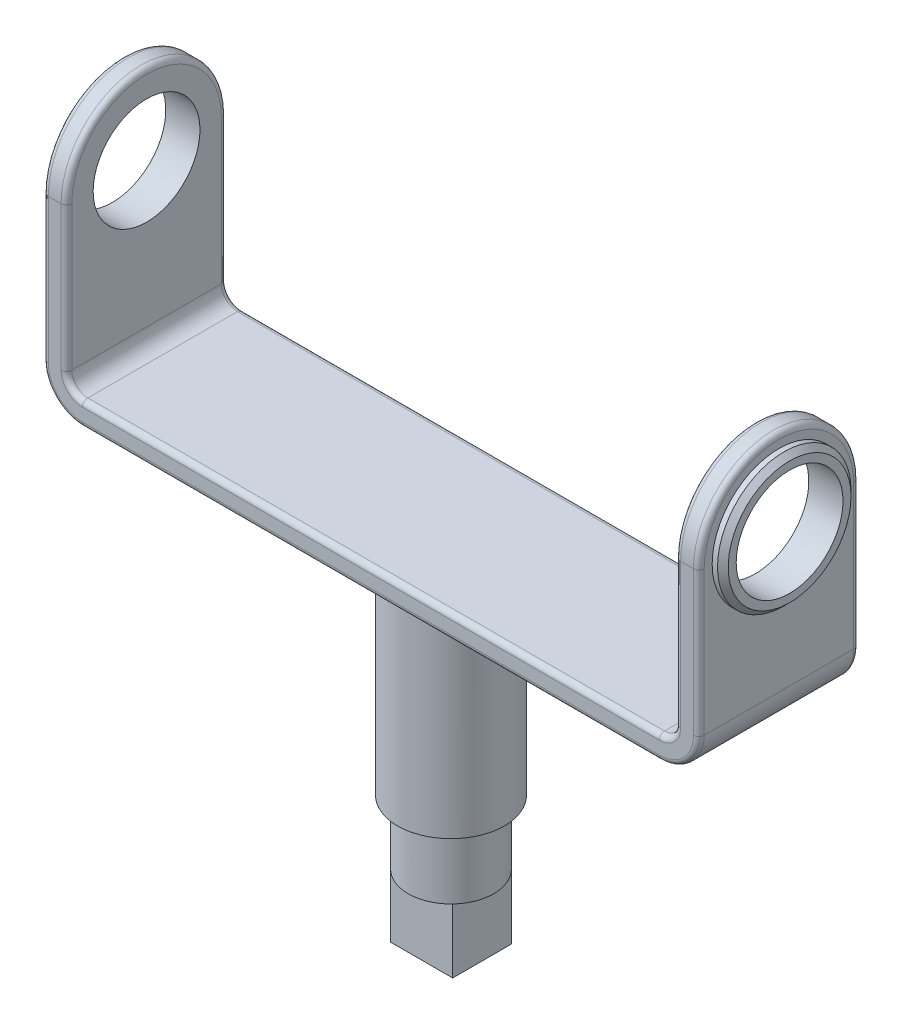
from build123d import *
from build123d.topology import SkipClean

# Parameters (mm, degrees)
EXTRUDE_THIN1_DEPTH     = 7.5
BOSS_EXTRUDE4_DEPTH     = 2.2
BOSS_EXTRUDE5_START     = -2.2
BOSS_EXTRUDE5_DEPTH     = 2.2
CUT_EXTRUDE1_DEPTH      = 66.821425083
CUT_EXTRUDE1_DEPTH_BACK = 66.821425083
SKETCH4_R               = 5
SKETCH5_R               = 5
BOSS_EXTRUDE6_DEPTH     = 20
SKETCH6_R               = 4
BOSS_EXTRUDE7_DEPTH     = 6
SKETCH7_W               = 5.80947502
SKETCH7_H               = 5.5
BOSS_EXTRUDE8_DEPTH     = 6
BOSS_EXTRUDE11_START    = 1
SKETCH8_R               = 6.25
SKETCH8_R_2             = 5
BOSS_EXTRUDE11_DEPTH    = 1
SKETCH9_R               = 6.25
SKETCH9_R_2             = 5
BOSS_EXTRUDE12_DEPTH    = 1
CHAMFER2_SIZE           = 0.5
CHAMFER3_SIZE           = 0.5
FILLET1_R               = 0.5


with BuildPart() as part:
    # Sketch1 → Extrude-Thin1 (new, symmetric)
    with BuildSketch(Plane.XY):
        with BuildLine():
            Line((57, 15), (57, 1.5))
            ThreePointArc((57, 1.5), (56.560660172, 0.439339828), (55.5, 0))
            Line((55.5, 0), (1.5, 0))
            ThreePointArc((1.5, 0), (0.439339828, 0.439339828), (0, 1.5))
            Line((0, 1.5), (0, 15))
            Line((0, 15), (-2.2, 15))
            Line((-2.2, 15), (-2.2, 1.5))
            ThreePointArc((-2.2, 1.5), (-1.11629509, -1.11629509), (1.5, -2.2))
            Line((1.5, -2.2), (55.5, -2.2))
            ThreePointArc((55.5, -2.2), (58.11629509, -1.11629509), (59.2, 1.5))
            Line((59.2, 1.5), (59.2, 15))
            Line((59.2, 15), (57, 15))
        make_face()
    extrude(amount=EXTRUDE_THIN1_DEPTH, both=True)

    # Sketch2 → Boss-Extrude4 (add)
    with BuildSketch(Plane(origin=(59.2, 0, 0), x_dir=(0, 0, -1), z_dir=(1, 0, 0))):
        with BuildLine():
            Line((7.5, 1.5), (7.5, 15))
            ThreePointArc((7.5, 15), (0, 22.5), (-7.5, 15))
            Line((-7.5, 15), (-7.5, 1.5))
            Line((-7.5, 1.5), (7.5, 1.5))
        make_face()
    extrude(amount=-BOSS_EXTRUDE4_DEPTH)

    # Sketch3 → Boss-Extrude5 (add)
    with BuildSketch(Plane.ZY.offset(2.2).offset(BOSS_EXTRUDE5_START)):
        with BuildLine():
            Line((7.5, 15), (-7.5, 15))
            ThreePointArc((-7.5, 15), (0, 22.5), (7.5, 15))
        make_face()
    extrude(amount=BOSS_EXTRUDE5_DEPTH)

    # Sketch4 → Cut-Extrude1 (cut, two sides: drawn at the far end of the back side and taken through both)
    with BuildSketch(Plane.ZY.offset(2.2).offset(-CUT_EXTRUDE1_DEPTH_BACK)):
        with Locations(Location((0, 15, 0), (0, 0, 180))):
            Circle(SKETCH4_R)
    extrude(amount=CUT_EXTRUDE1_DEPTH + CUT_EXTRUDE1_DEPTH_BACK, mode=Mode.SUBTRACT)

    # Sketch5 → Boss-Extrude6 (add)
    with BuildSketch(Plane.XZ.offset(2.2)):
        with Locations(Location((28.5, 0, 0), (0, 0, 90))):
            Circle(SKETCH5_R)
    extrude(amount=BOSS_EXTRUDE6_DEPTH)

    # Sketch6 → Boss-Extrude7 (add)
    with BuildSketch(Plane.XZ.offset(22.2)):
        with Locations(Location((28.5, 0, 0), (0, 0, 270))):
            Circle(SKETCH6_R)
    extrude(amount=BOSS_EXTRUDE7_DEPTH)

    # Sketch7 → Boss-Extrude8 (add)
    with BuildSketch(Plane.XZ.offset(28.2)):
        with Locations((28.5, 0)):
            Rectangle(SKETCH7_W, SKETCH7_H)
    extrude(amount=BOSS_EXTRUDE8_DEPTH)

    # Sketch8 → Boss-Extrude11 (add)
    with BuildSketch(Plane.ZY.offset(2.2).offset(BOSS_EXTRUDE11_START)):
        with Locations(Location((0, 15, 0), (0, 0, 180))):
            Circle(SKETCH8_R)
        with Locations((0, 15)):
            Circle(SKETCH8_R_2, mode=Mode.SUBTRACT)
    extrude(amount=-BOSS_EXTRUDE11_DEPTH)

    # Sketch9 → Boss-Extrude12 (add)
    with SkipClean():  # the faces are left unmerged after this step: merging them gives an invalid solid
        with BuildSketch(Plane(origin=(59.2, 0, 0), x_dir=(0, 0, -1), z_dir=(1, 0, 0))):
            with Locations((0, 15)):
                Circle(SKETCH9_R)
            with Locations(Location((0, 15, 0), (0, 0, 180))):
                Circle(SKETCH9_R_2, mode=Mode.SUBTRACT)
        extrude(amount=BOSS_EXTRUDE12_DEPTH)

    # Chamfer2
    chamfer2_edges = [part.edges().sort_by_distance(p)[0] for p in [
        (60.2, 15, 6.25),
    ]]
    chamfer(chamfer2_edges, length=CHAMFER2_SIZE)

    # Chamfer3
    chamfer3_edges = [part.edges().sort_by_distance(p)[0] for p in [
        (-3.2, 15, 6.25),
    ]]
    chamfer(chamfer3_edges, length=CHAMFER3_SIZE)

    # Fillet1
    fillet1_edges = [part.edges().sort_by_distance(p)[0] for p in [
        (58.11629509, -1.11629509, -7.5),
        (28.5, -2.2, -7.5),
        (-1.11629509, -1.11629509, -7.5),
        (-2.2, 8.25, -7.5),
        (0, 8.25, -7.5),
        (0.439339828, 0.439339828, -7.5),
        (28.5, 0, -7.5),
        (57, 8.25, 7.5),
        (56.560660172, 0.439339828, -7.5),
        (57, 8.25, -7.5),
        (59.2, 8.25, -7.5),
        (56.560660172, 0.439339828, 7.5),
        (28.5, 0, 7.5),
        (0.439339828, 0.439339828, 7.5),
        (0, 8.25, 7.5),
        (57, 22.5, 0),
        (59.2, 22.5, 0),
        (-2.2, 8.25, 7.5),
        (-1.11629509, -1.11629509, 7.5),
        (28.5, -2.2, 7.5),
        (0, 22.5, 0),
        (-2.2, 22.5, 0),
        (58.11629509, -1.11629509, 7.5),
        (59.2, 8.25, 7.5),
    ]]
    fillet(fillet1_edges, radius=FILLET1_R)


solid = part.part
